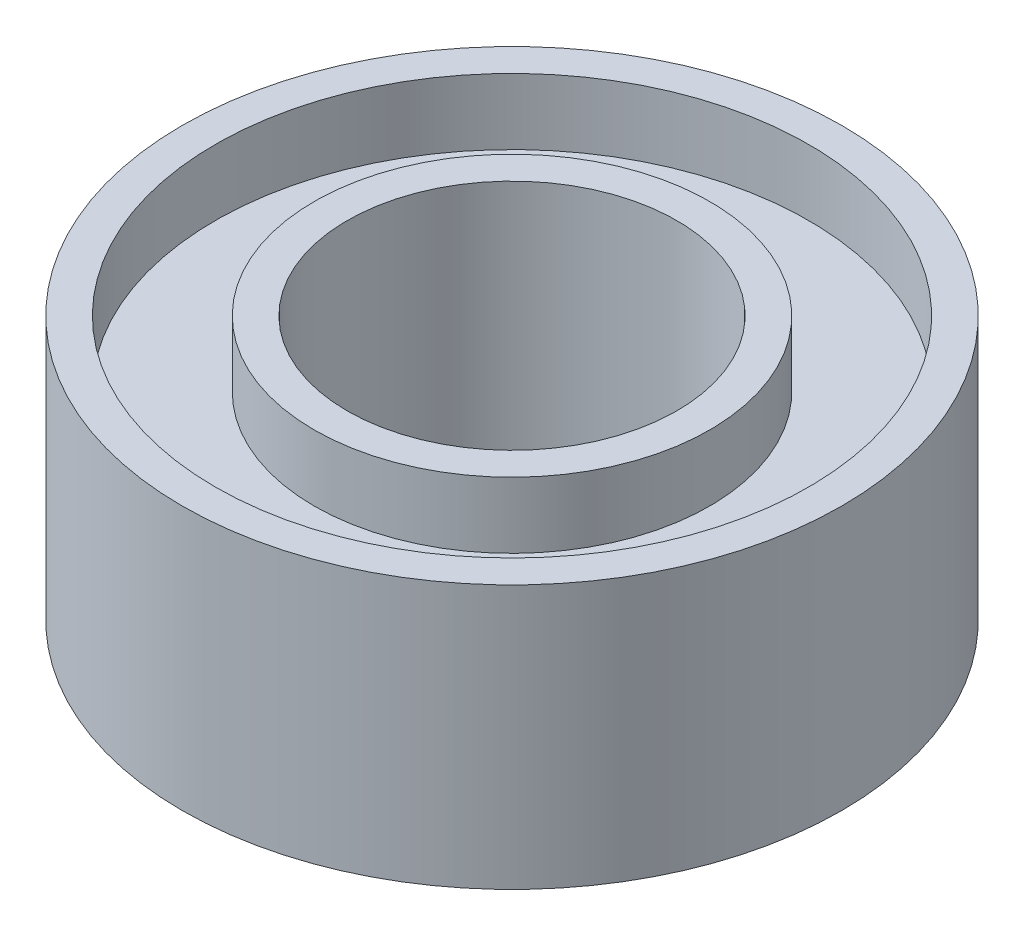
from build123d import *

# Parameters (mm, degrees)
SKETCH1_R           = 5
SKETCH1_R_2         = 2.5
BOSS_EXTRUDE1_DEPTH = 4
SKETCH2_R           = 4.5
SKETCH2_R_2         = 3
CUT_EXTRUDE1_DEPTH  = 1
CUT_EXTRUDE2_START  = -1
SKETCH3_R           = 4.5
SKETCH3_R_2         = 3
CUT_EXTRUDE2_DEPTH  = 1


with BuildPart() as part:
    # Sketch1 → Boss-Extrude1 (new body)
    with BuildSketch(Plane(origin=(0, 0, 0), x_dir=(1, 0, 0), z_dir=(0, 1, 0))):
        with Locations(Location((0, 0, 0), (0, 0, 270))):
            Circle(SKETCH1_R)
        with Locations(Location((0, 0, 0), (0, 0, 270))):
            Circle(SKETCH1_R_2, mode=Mode.SUBTRACT)
    extrude(amount=BOSS_EXTRUDE1_DEPTH)

    # Sketch2 → Cut-Extrude1 (cut)
    with BuildSketch(Plane(origin=(0, 4, 0), x_dir=(1, 0, 0), z_dir=(0, 1, 0))):
        with Locations(Location((0, 0, 0), (0, 0, 270))):
            Circle(SKETCH2_R)
        with Locations(Location((0, 0, 0), (0, 0, 270))):
            Circle(SKETCH2_R_2, mode=Mode.SUBTRACT)
    extrude(amount=-CUT_EXTRUDE1_DEPTH, mode=Mode.SUBTRACT)

    # Sketch3 → Cut-Extrude2 (cut)
    with BuildSketch(Plane.XZ.offset(CUT_EXTRUDE2_START)):
        with Locations(Location((0, 0, 0), (0, 0, 90))):
            Circle(SKETCH3_R)
        with Locations(Location((0, 0, 0), (0, 0, 90))):
            Circle(SKETCH3_R_2, mode=Mode.SUBTRACT)
    extrude(amount=CUT_EXTRUDE2_DEPTH, mode=Mode.SUBTRACT)


solid = part.part
